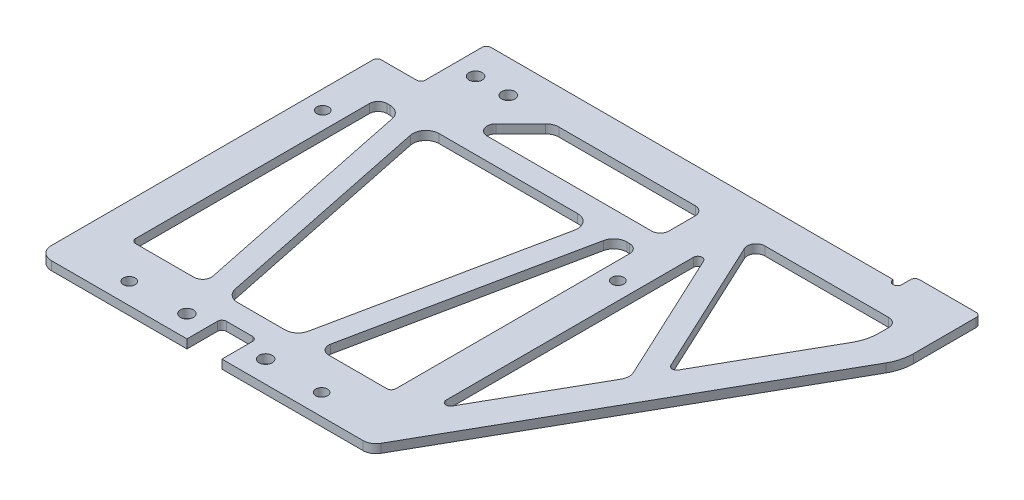
from build123d import *

# Parameters (mm, degrees)
SKETCH_1_R          = 1.5
EXTRUDE_1_DEPTH     = 2
SKETCH_4_R          = 1.35
SKETCH_4_R_2        = 1.5
SKETCH_4_W          = 8
SKETCH_4_H          = 8
CUT_EXTRUDE_2_DEPTH = 144.736738519
SKETCH_5_R          = 1
CUT_EXTRUDE_3_DEPTH = 144.736738519
FILLET_4_R          = 1
SKETCH_2_W          = 59.5
SKETCH_2_H          = 56.5
CUT_EXTRUDE_1_DEPTH = 144.736738519
EXTRUDE_1_2_DEPTH   = 2
FILLET_1_R          = 1
FILLET_3_R          = 3
FILLET_2_R          = 2
FILLET_5_R          = 10


with BuildPart() as part:
    # 草图1 → Extrude 1 (new body)
    with BuildSketch(Plane(origin=(0, 0, 0), x_dir=(1, 0, 0), z_dir=(0, 1, 0))):
        Polygon((0, 0), (95, 0), (95, 3), (110, 3), (110, -15), (66, -92.5), (-10, -92.5), (-10, -15), (0, -15), align=None)
        with Locations(Location((5, -7.5, 0), (0, 0, 270))):
            Circle(SKETCH_1_R, mode=Mode.SUBTRACT)
        with Locations(Location((12.5, -7.5, 0), (0, 0, 270))):
            Circle(SKETCH_1_R, mode=Mode.SUBTRACT)
    extrude(amount=EXTRUDE_1_DEPTH)

    # 草图4 → 切除-拉伸2 (cut, through all)
    with BuildSketch(Plane(origin=(0, 2, 0), x_dir=(1, 0, 0), z_dir=(0, 1, 0))):
        with Locations(Location((-5.75, -31.7, 0), (0, 0, 270))):
            Circle(SKETCH_4_R)
        with Locations(Location((6, -87.7, 0), (0, 0, 270))):
            Circle(SKETCH_4_R)
        with Locations(Location((50, -87.7, 0), (0, 0, 90))):
            Circle(SKETCH_4_R)
        with Locations(Location((61.75, -31.7, 0), (0, 0, 90))):
            Circle(SKETCH_4_R)
        with Locations(Location((19, -87.5, 0), (0, 0, 270))):
            Circle(SKETCH_4_R_2)
        with Locations(Location((37, -87.5, 0), (0, 0, 90))):
            Circle(SKETCH_4_R_2)
        with Locations((28, -88.5)):
            Rectangle(SKETCH_4_W, SKETCH_4_H)
    extrude(amount=-CUT_EXTRUDE_2_DEPTH, mode=Mode.SUBTRACT)

    # 草图5 → 切除-拉伸3 (cut, through all)
    with BuildSketch(Plane(origin=(0, 2, 0), x_dir=(1, 0, 0), z_dir=(0, 1, 0))):
        with Locations((94, 0)):
            Circle(SKETCH_5_R)
    extrude(amount=-CUT_EXTRUDE_3_DEPTH, mode=Mode.SUBTRACT)

    # 圆角4
    fillet_4_edges = [part.edges().sort_by_distance(p)[0] for p in [
        (95, 1, -3),
        (110, 1, -3),
    ]]
    fillet(fillet_4_edges, radius=FILLET_4_R)

    # 草图2 → 切除-拉伸1 (cut, through all)
    with BuildSketch(Plane(origin=(0, 2, 0), x_dir=(1, 0, 0), z_dir=(0, 1, 0))):
        with Locations((28, -51.25)):
            Rectangle(SKETCH_2_W, SKETCH_2_H)
        Polygon((65.75, -78.762270127), (102, -14.912838308), (102, -8), (65.75, -8), align=None)
        Polygon((23.313708499, -8), (57.75, -8), (57.75, -18), (13.313708499, -18), align=None)
    extrude(amount=-CUT_EXTRUDE_1_DEPTH, mode=Mode.SUBTRACT)

    # 草图3 → Extrude 1 2 (add)
    with BuildSketch(Plane(origin=(0, 2, 0), x_dir=(1, 0, 0), z_dir=(0, 1, 0))):
        Polygon((87.178028776, -48.003607703), (68.015439788, -6.942747632), (63.484560212, -9.057252368), (82.647149201, -50.118112438), align=None)
        Polygon((3.051710613, -21.505844915), (15.551710613, -82.005844915), (20.448289387, -80.994155085), (7.948289387, -20.494155085), align=None)
        Polygon((48.051710613, -20.494155085), (35.551710613, -80.994155085), (40.448289387, -82.005844915), (52.948289387, -21.505844915), align=None)
    extrude(amount=-EXTRUDE_1_2_DEPTH)

    # 圆角1
    fillet_1_edges = [part.edges().sort_by_distance(p)[0] for p in [
        (65.75, 1, 78.762270127),
        (-1.75, 1, 79.5),
        (57.75, 1, 79.5),
        (0, 1, 0),
        (65.75, 1, 13.911549779),
        (-10, 1, 15),
        (0, 1, 15),
        (85.389180361, 1, 44.17053199),
        (24, 1, 84.5),
        (32, 1, 84.5),
    ]]
    fillet(fillet_1_edges, radius=FILLET_1_R)

    # 圆角3
    fillet_3_edges = [part.edges().sort_by_distance(p)[0] for p in [
        (23.313708499, 1, 8),
        (66, 1, 92.5),
        (-10, 1, 92.5),
        (82.360819639, 1, 49.504576445),
        (20.139579659, 1, 79.5),
        (3.360420341, 1, 23),
        (8.46602594, 1, 23),
        (47.53397406, 1, 23),
        (52.639579659, 1, 23),
        (35.860420341, 1, 79.5),
    ]]
    fillet(fillet_3_edges, radius=FILLET_3_R)

    # 圆角2
    fillet_2_edges = [part.edges().sort_by_distance(p)[0] for p in [
        (102, 1, 8),
        (-1.75, 1, 23),
        (57.75, 1, 23),
        (13.313708499, 1, 18),
        (57.75, 1, 8),
        (57.75, 1, 18),
        (68.508846222, 1, 8),
        (15.03397406, 1, 79.5),
        (40.96602594, 1, 79.5),
    ]]
    fillet(fillet_2_edges, radius=FILLET_2_R)

    # 圆角5
    fillet_5_edges = [part.edges().sort_by_distance(p)[0] for p in [
        (102, 1, 14.912838308),
        (110, 1, 15),
    ]]
    fillet(fillet_5_edges, radius=FILLET_5_R)


solid = part.part
